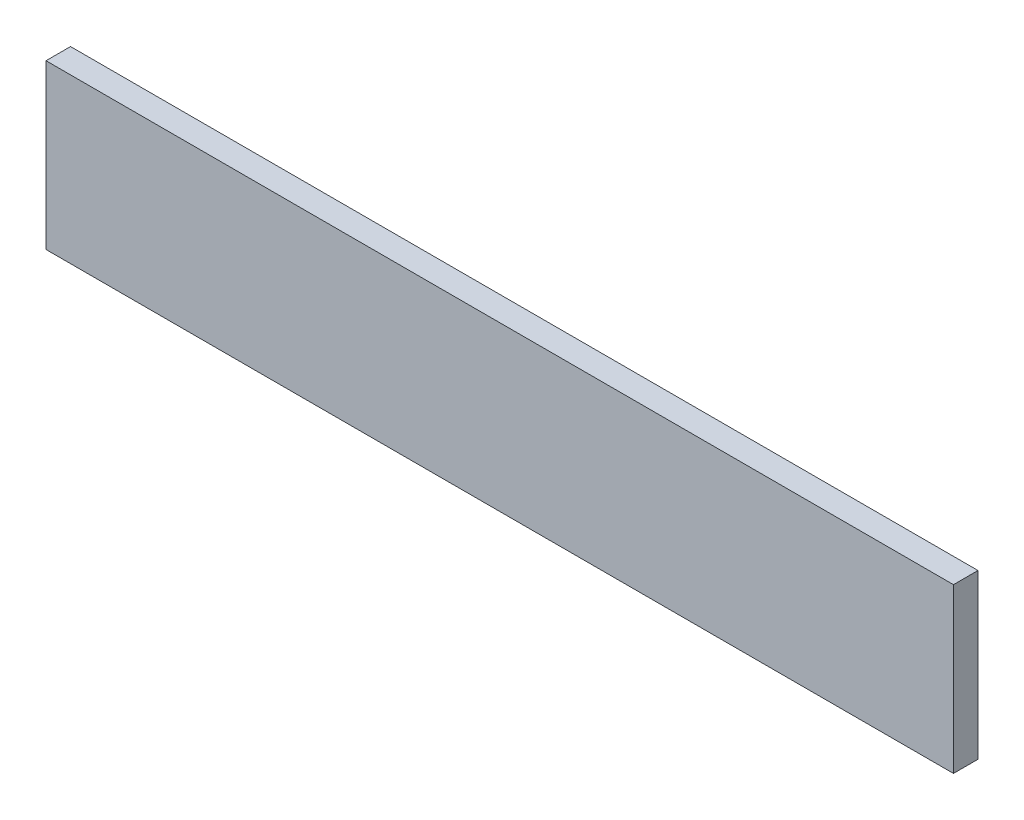
from build123d import *

# Parameters (mm, degrees)
SKETCH1_W           = 704.85
SKETCH1_H           = 127
BOSS_EXTRUDE1_DEPTH = 19.05


with BuildPart() as part:
    # Sketch1 → Boss-Extrude1 (new body)
    with BuildSketch(Plane.XY):
        with Locations((352.425, 63.5)):
            Rectangle(SKETCH1_W, SKETCH1_H)
    extrude(amount=BOSS_EXTRUDE1_DEPTH)


solid = part.part
